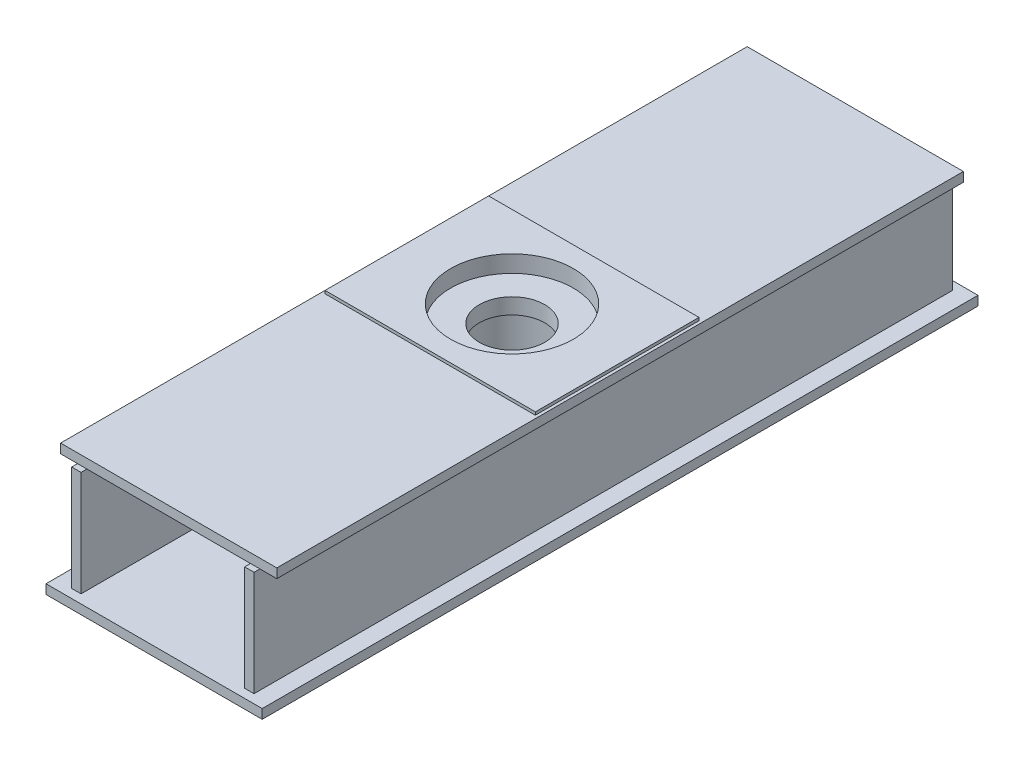
from build123d import *

# Parameters (mm, degrees)
SKETCH_1_W               = 1225
SKETCH_1_H               = 370
EXTRUDE_1_DEPTH          = 16
SKETCH_2_W               = 280
SKETCH_2_H               = 280
EXTRUDE_2_DEPTH          = 10
SKETCH_3_R               = 85
SKETCH_3_R_2             = 75
EXTRUDE_3_DEPTH          = 135
EXTRUDE_4_DEPTH          = 135
PATTERN_CIRCULAR_1_COUNT = 8
SKETCH_5_W               = 280
SKETCH_5_H               = 280
SKETCH_5_R               = 56
EXTRUDE_5_DEPTH          = 35
SKETCH_6_R               = 105
CUT_EXTRUDE_1_DEPTH      = 8
SKETCH_7_W               = 16
SKETCH_7_H               = 1195
EXTRUDE_8_DEPTH          = 180
EXTRUDE_START            = 16
SKETCH_8_W               = 370
SKETCH_8_H               = 1175
SKETCH_8_R               = 105
EXTRUDE_9_DEPTH          = 16
EXTRUDE_START_2          = 5
SKETCH_9_W               = 360
SKETCH_9_H               = 280
SKETCH_9_R               = 105
EXTRUDE_10_DEPTH         = 5


with BuildPart() as part:
    # 草图1 → 凸台-拉伸1 (new body)
    with BuildSketch(Plane(origin=(0, 0, 0), x_dir=(0, 0, -1), z_dir=(0, 1, 0))):
        Rectangle(SKETCH_1_W, SKETCH_1_H)
    extrude(amount=EXTRUDE_1_DEPTH)

    # 草图2 → 凸台-拉伸2 (add)
    with BuildSketch(Plane(origin=(0, 16, 0), x_dir=(1, 0, 0), z_dir=(0, 1, 0))):
        Rectangle(SKETCH_2_W, SKETCH_2_H)
    extrude(amount=EXTRUDE_2_DEPTH)

    # 草图3 → 凸台-拉伸3 (add)
    with BuildSketch(Plane(origin=(0, 26, 0), x_dir=(1, 0, 0), z_dir=(0, 1, 0))):
        with Locations(Location((0, 0, 0), (0, 0, 270))):
            Circle(SKETCH_3_R)
        with Locations(Location((0, 0, 0), (0, 0, 270))):
            Circle(SKETCH_3_R_2, mode=Mode.SUBTRACT)
    extrude(amount=EXTRUDE_3_DEPTH)

    # 草图4 → 凸台-拉伸4 (add)
    with BuildSketch(Plane(origin=(0, 26, 0), x_dir=(1, 0, 0), z_dir=(0, 1, 0))):
        with BuildLine():
            Line((27.852368346, 80.307195054), (52.577523517, 139.999))
            Line((52.577523517, 139.999), (61.816318842, 136.172165676))
            Line((61.816318842, 136.172165676), (37.091163671, 76.480360731))
            ThreePointArc((37.091163671, 76.480360731), (32.528091751, 78.529760263), (27.852368346, 80.307195054))
        make_face()
    extrude_4 = extrude(amount=EXTRUDE_4_DEPTH)

    # 阵列(圆周)1: 凸台-拉伸4 ×8 about axis
    pattern_circular_1_axis = Axis((0, 0, 0), (0, 1, 0))
    for i in range(1, PATTERN_CIRCULAR_1_COUNT):
        add(extrude_4.rotate(pattern_circular_1_axis, i * 360 / PATTERN_CIRCULAR_1_COUNT))

    # 草图5 → 凸台-拉伸5 (add)
    with BuildSketch(Plane(origin=(0, 161, 0), x_dir=(1, 0, 0), z_dir=(0, 1, 0))):
        Rectangle(SKETCH_5_W, SKETCH_5_H)
        with Locations(Location((0, 0, 0), (0, 0, 270))):
            Circle(SKETCH_5_R, mode=Mode.SUBTRACT)
    extrude(amount=EXTRUDE_5_DEPTH)

    # 草图6 → 切除-拉伸1 (cut)
    with BuildSketch(Plane(origin=(0, 196, 0), x_dir=(1, 0, 0), z_dir=(0, 1, 0))):
        with Locations(Location((0, 0, 0), (0, 0, 270))):
            Circle(SKETCH_6_R)
    extrude(amount=-CUT_EXTRUDE_1_DEPTH, mode=Mode.SUBTRACT)

    # 草图7 → 凸台-拉伸8 (add)
    with BuildSketch(Plane(origin=(0, 16, 0), x_dir=(1, 0, 0), z_dir=(0, 1, 0))):
        with Locations((-148, 0)):
            Rectangle(SKETCH_7_W, SKETCH_7_H)
        with Locations((148, 0)):
            Rectangle(SKETCH_7_W, SKETCH_7_H)
    extrude(amount=EXTRUDE_8_DEPTH)

    # 草图8 → 凸台-拉伸9 (add)
    with BuildSketch(Plane(origin=(0, 196, 0), x_dir=(1, 0, 0), z_dir=(0, 1, 0)).offset(EXTRUDE_START)):
        Rectangle(SKETCH_8_W, SKETCH_8_H)
        with Locations(Location((0, 0, 0), (0, 0, 270))):
            Circle(SKETCH_8_R, mode=Mode.SUBTRACT)
    extrude(amount=-EXTRUDE_9_DEPTH)

    # 草图9 → 凸台-拉伸10 (add)
    with BuildSketch(Plane(origin=(0, 212, 0), x_dir=(1, 0, 0), z_dir=(0, 1, 0)).offset(EXTRUDE_START_2)):
        Rectangle(SKETCH_9_W, SKETCH_9_H)
        with Locations(Location((0, 0, 0), (0, 0, 270))):
            Circle(SKETCH_9_R, mode=Mode.SUBTRACT)
    extrude(amount=-EXTRUDE_10_DEPTH)


solid = part.part
